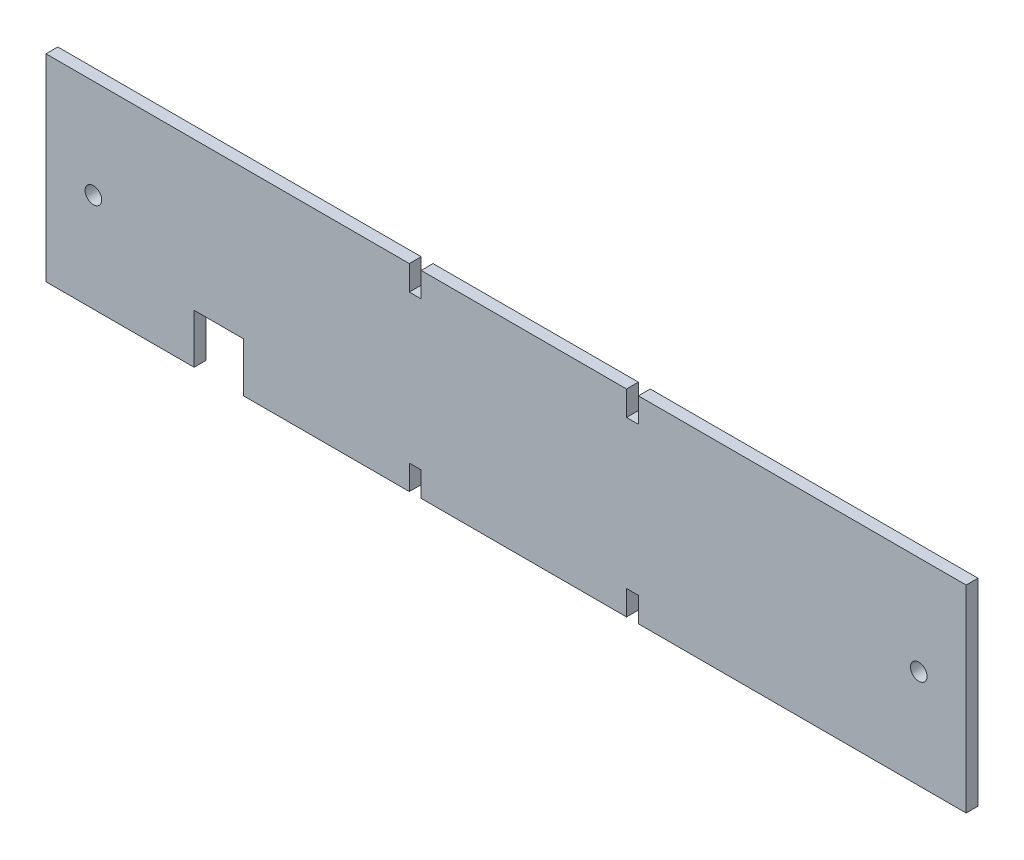
from build123d import *

# Parameters (mm, degrees)
SKETCH1_W            = 466
SKETCH1_H            = 100
BOSS_EXTRUDE1_DEPTH  = 6
M8_CLEARANCE_SLOT1_D = 8.4
SKETCH4_W            = 25
SKETCH4_H            = 25
CUT_EXTRUDE1_DEPTH   = 12
SKETCH5_W            = 6
SKETCH5_H            = 12.5
CUT_EXTRUDE2_DEPTH   = 477.646619625


with BuildPart() as part:
    # Sketch1 → Boss-Extrude1 (new body)
    with BuildSketch(Plane.XY):
        with Locations((233, 50)):
            Rectangle(SKETCH1_W, SKETCH1_H)
    extrude(amount=BOSS_EXTRUDE1_DEPTH)

    # M8 Clearance Slot1 (through all)
    with Locations(Plane.XY.offset(6)):
        with Locations((24, 50), (442, 50)):
            Hole(M8_CLEARANCE_SLOT1_D / 2)

    # Sketch4 → Cut-Extrude1 (cut)
    with BuildSketch(Plane(origin=(0, 0, 0), x_dir=(-1, 0, 0), z_dir=(0, 0, -1))):
        with Locations((-87.5, 12.5)):
            Rectangle(SKETCH4_W, SKETCH4_H)
    extrude(amount=-CUT_EXTRUDE1_DEPTH, mode=Mode.SUBTRACT)

    # Sketch5 → Cut-Extrude2 (cut, through all)
    with BuildSketch(Plane(origin=(0, 0, 0), x_dir=(-1, 0, 0), z_dir=(0, 0, -1))):
        with Locations((-297, 93.75)):
            Rectangle(SKETCH5_W, SKETCH5_H)
        with Locations((-187, 93.75)):
            Rectangle(SKETCH5_W, SKETCH5_H)
        with Locations((-297, 6.25)):
            Rectangle(SKETCH5_W, SKETCH5_H)
        with Locations((-187, 6.25)):
            Rectangle(SKETCH5_W, SKETCH5_H)
    extrude(amount=-CUT_EXTRUDE2_DEPTH, mode=Mode.SUBTRACT)


solid = part.part
